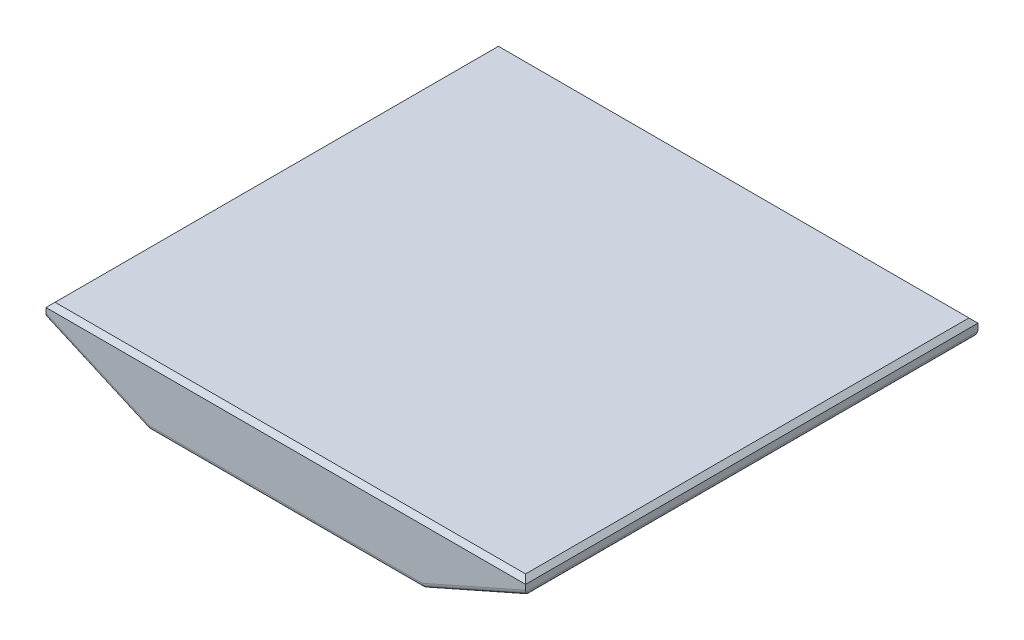
from build123d import *

# Parameters (mm, degrees)
EXTRUDE_1_DEPTH = 50
CHAMFER_1_SIZE  = 0.5
FILLET_1_R      = 0.5


with BuildPart() as part:
    # Эскиз1 → Бобышка-Вытянуть1 (new body)
    with BuildSketch(Plane.XY):
        Polygon((-26.5, 0), (26.5, 0), (26.5, -1.6), (15.2, -6.6), (-15.2, -6.6), (-26.5, -1.6), align=None)
    extrude(amount=EXTRUDE_1_DEPTH)

    # Фаска1
    chamfer_1_edges = [part.edges().sort_by_distance(p)[0] for p in [
        (-26.5, 0, 25),
        (26.5, 0, 25),
        (0, 0, 0),
        (0, 0, 50),
    ]]
    chamfer(chamfer_1_edges, length=CHAMFER_1_SIZE)

    # Скругление1
    fillet_1_edges = [part.edges().sort_by_distance(p)[0] for p in [
        (26.5, -1.6, 25),
        (15.2, -6.6, 25),
        (-15.2, -6.6, 25),
        (-26.5, -1.6, 25),
        (-20.85, -4.1, 50),
        (0, -6.6, 50),
        (20.85, -4.1, 50),
        (20.85, -4.1, 0),
        (0, -6.6, 0),
        (-20.85, -4.1, 0),
    ]]
    fillet(fillet_1_edges, radius=FILLET_1_R)


solid = part.part
